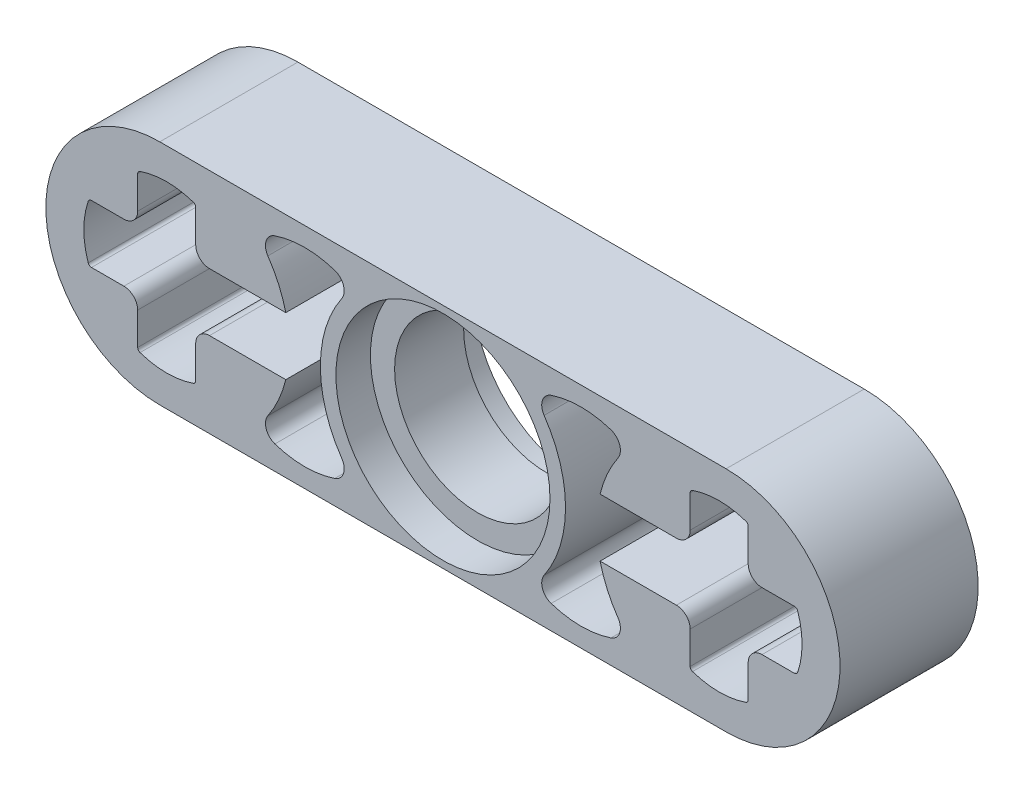
from build123d import *

# Parameters (mm, degrees)
SKETCH2_R           = 2.4
BOSS_EXTRUDE1_DEPTH = 2
SKETCH4_R           = 3.1
CUT_EXTRUDE1_DEPTH  = 1


with BuildPart() as part:
    # Sketch2 → Boss-Extrude1 (new, symmetric)
    with BuildSketch(Plane.XY):
        with BuildLine():
            Line((8.2, 3.3), (-8.2, 3.3))
            ThreePointArc((-8.2, 3.3), (-11.5, 0), (-8.2, -3.3))
            Line((-8.2, -3.3), (8.2, -3.3))
            ThreePointArc((8.2, -3.3), (11.5, 0), (8.2, 3.3))
        make_face()
        with BuildLine():
            Line((-10.177705214, 0.84), (-9.24, 0.84))
            ThreePointArc((-9.24, 0.84), (-8.957157288, 0.957157288), (-8.84, 1.24))
            Line((-8.84, 1.24), (-8.84, 2.177705214))
            ThreePointArc((-8.84, 2.177705214), (-8.821293884, 2.235940121), (-8.772173913, 2.27238805))
            ThreePointArc((-8.772173913, 2.27238805), (-8, 2.4), (-7.227826087, 2.27238805))
            ThreePointArc((-7.227826087, 2.27238805), (-7.178706116, 2.235940121), (-7.16, 2.177705214))
            Line((-7.16, 2.177705214), (-7.16, 1.24))
            ThreePointArc((-7.16, 1.24), (-7.042842712, 0.957157288), (-6.76, 0.84))
            Line((-6.76, 0.84), (-5.822294786, 0.84))
            Line((-5.822294786, 0.84), (-5.751800721, 0.84))
            Line((-5.751800721, 0.84), (-4.55081169, 0.84))
            ThreePointArc((-4.55081169, 0.84), (-4.757752494, 1.445797742), (-5.070126582, 2.004580194))
            ThreePointArc((-5.070126582, 2.004580194), (-5.119033599, 2.358251088), (-4.865957447, 2.610099174))
            ThreePointArc((-4.865957447, 2.610099174), (-4, 2.75), (-3.134042553, 2.610099174))
            ThreePointArc((-3.134042553, 2.610099174), (-2.880966401, 2.358251088), (-2.929873418, 2.004580194))
            ThreePointArc((-2.929873418, 2.004580194), (-3.55, 0), (-2.929873418, -2.004580194))
            ThreePointArc((-2.929873418, -2.004580194), (-2.880966401, -2.358251088), (-3.134042553, -2.610099174))
            ThreePointArc((-3.134042553, -2.610099174), (-4, -2.75), (-4.865957447, -2.610099174))
            ThreePointArc((-4.865957447, -2.610099174), (-5.119033599, -2.358251088), (-5.070126582, -2.004580194))
            ThreePointArc((-5.070126582, -2.004580194), (-4.757752494, -1.445797742), (-4.55081169, -0.84))
            Line((-4.55081169, -0.84), (-5.751800721, -0.84))
            Line((-5.751800721, -0.84), (-5.822294786, -0.84))
            Line((-5.822294786, -0.84), (-6.76, -0.84))
            ThreePointArc((-6.76, -0.84), (-7.042842712, -0.957157288), (-7.16, -1.24))
            Line((-7.16, -1.24), (-7.16, -2.177705214))
            ThreePointArc((-7.16, -2.177705214), (-7.178706116, -2.235940121), (-7.227826087, -2.27238805))
            ThreePointArc((-7.227826087, -2.27238805), (-8, -2.4), (-8.772173913, -2.27238805))
            ThreePointArc((-8.772173913, -2.27238805), (-8.821293884, -2.235940121), (-8.84, -2.177705214))
            Line((-8.84, -2.177705214), (-8.84, -1.24))
            ThreePointArc((-8.84, -1.24), (-8.957157288, -0.957157288), (-9.24, -0.84))
            Line((-9.24, -0.84), (-10.177705214, -0.84))
            ThreePointArc((-10.177705214, -0.84), (-10.235940121, -0.821293884), (-10.27238805, -0.772173913))
            ThreePointArc((-10.27238805, -0.772173913), (-10.4, 0), (-10.27238805, 0.772173913))
            ThreePointArc((-10.27238805, 0.772173913), (-10.235940121, 0.821293884), (-10.177705214, 0.84))
        make_face(mode=Mode.SUBTRACT)
        Circle(SKETCH2_R, mode=Mode.SUBTRACT)
        with BuildLine():
            Line((8.84, 2.177705214), (8.84, 1.24))
            ThreePointArc((8.84, 1.24), (8.957157288, 0.957157288), (9.24, 0.84))
            Line((9.24, 0.84), (10.177705214, 0.84))
            ThreePointArc((10.177705214, 0.84), (10.235940121, 0.821293884), (10.27238805, 0.772173913))
            ThreePointArc((10.27238805, 0.772173913), (10.4, 0), (10.27238805, -0.772173913))
            ThreePointArc((10.27238805, -0.772173913), (10.235940121, -0.821293884), (10.177705214, -0.84))
            Line((10.177705214, -0.84), (9.24, -0.84))
            ThreePointArc((9.24, -0.84), (8.957157288, -0.957157288), (8.84, -1.24))
            Line((8.84, -1.24), (8.84, -2.177705214))
            ThreePointArc((8.84, -2.177705214), (8.821293884, -2.235940121), (8.772173913, -2.27238805))
            ThreePointArc((8.772173913, -2.27238805), (8, -2.4), (7.227826087, -2.27238805))
            ThreePointArc((7.227826087, -2.27238805), (7.178706116, -2.235940121), (7.16, -2.177705214))
            Line((7.16, -2.177705214), (7.16, -1.24))
            ThreePointArc((7.16, -1.24), (7.042842712, -0.957157288), (6.76, -0.84))
            Line((6.76, -0.84), (5.822294786, -0.84))
            Line((5.822294786, -0.84), (5.751800721, -0.84))
            Line((5.751800721, -0.84), (4.55081169, -0.84))
            ThreePointArc((4.55081169, -0.84), (4.757752494, -1.445797742), (5.070126582, -2.004580194))
            ThreePointArc((5.070126582, -2.004580194), (5.119033599, -2.358251088), (4.865957447, -2.610099174))
            ThreePointArc((4.865957447, -2.610099174), (4, -2.75), (3.134042553, -2.610099174))
            ThreePointArc((3.134042553, -2.610099174), (2.880966401, -2.358251088), (2.929873418, -2.004580194))
            ThreePointArc((2.929873418, -2.004580194), (3.55, 0), (2.929873418, 2.004580194))
            ThreePointArc((2.929873418, 2.004580194), (2.880966401, 2.358251088), (3.134042553, 2.610099174))
            ThreePointArc((3.134042553, 2.610099174), (4, 2.75), (4.865957447, 2.610099174))
            ThreePointArc((4.865957447, 2.610099174), (5.119033599, 2.358251088), (5.070126582, 2.004580194))
            ThreePointArc((5.070126582, 2.004580194), (4.757752494, 1.445797742), (4.55081169, 0.84))
            Line((4.55081169, 0.84), (5.751800721, 0.84))
            Line((5.751800721, 0.84), (5.822294786, 0.84))
            Line((5.822294786, 0.84), (6.76, 0.84))
            ThreePointArc((6.76, 0.84), (7.042842712, 0.957157288), (7.16, 1.24))
            Line((7.16, 1.24), (7.16, 2.177705214))
            ThreePointArc((7.16, 2.177705214), (7.178706116, 2.235940121), (7.227826087, 2.27238805))
            ThreePointArc((7.227826087, 2.27238805), (8, 2.4), (8.772173913, 2.27238805))
            ThreePointArc((8.772173913, 2.27238805), (8.821293884, 2.235940121), (8.84, 2.177705214))
        make_face(mode=Mode.SUBTRACT)
    extrude(amount=BOSS_EXTRUDE1_DEPTH, both=True)

    # Sketch4 → Cut-Extrude1 (cut)
    with BuildSketch(Plane.XY.offset(2)):
        Circle(SKETCH4_R)
    cut_extrude1 = extrude(amount=-CUT_EXTRUDE1_DEPTH, mode=Mode.SUBTRACT)

    # Mirror1: Cut-Extrude1 across plane
    add(cut_extrude1.mirror(Plane.XY), mode=Mode.SUBTRACT)


solid = part.part
